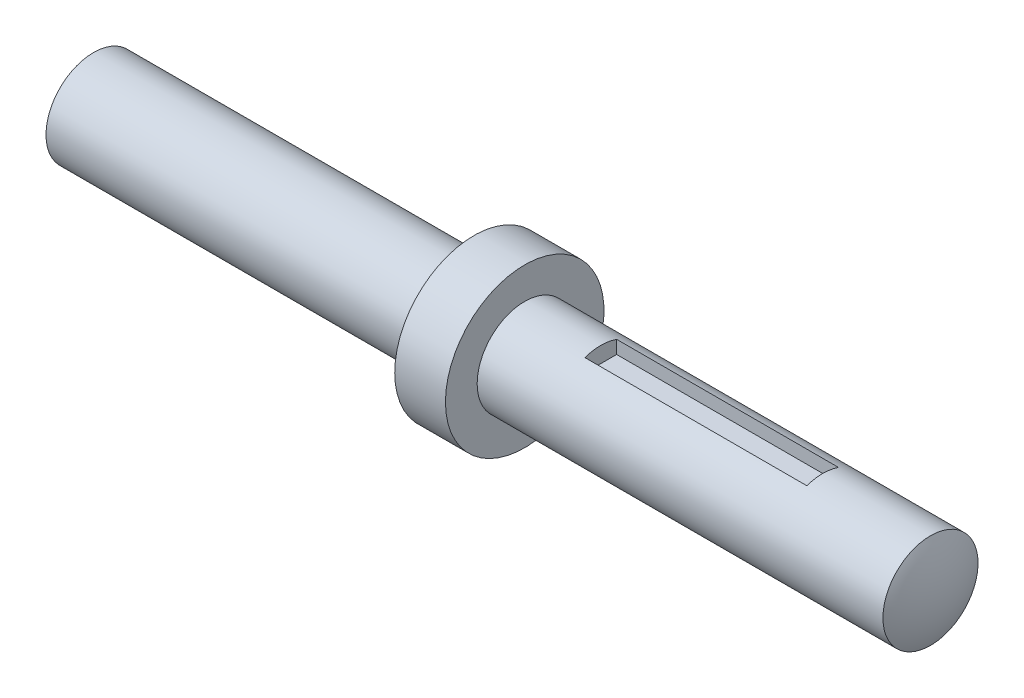
from build123d import *

# Parameters (mm, degrees)
CUT_EXTRUDE1_DEPTH = 2.5


with BuildPart() as part:
    # Sketch1 → Revolve1 (revolve)
    with BuildSketch(Plane.XY, mode=Mode.PRIVATE) as revolve1_sk:
        Polygon((-64, 7.5), (-64, 0), (68, 0), (68, 7.5), (4, 7.5), (4, 12.5), (-4, 12.5), (-4, 7.5), align=None)
        with BuildLine():
            Line((69.770509831, 0), (68, 0))
            Line((68, 0), (68, 7.5))
            ThreePointArc((68, 7.5), (69.321881746, 3.853073613), (69.770509831, 0))
        make_face()
        with BuildLine():
            Line((-64, 0), (-64, 7.5))
            ThreePointArc((-64, 7.5), (-65.321881746, 3.853073613), (-65.770509831, 0))
            Line((-65.770509831, 0), (-64, 0))
        make_face()
    revolve(revolve1_sk.sketch.rotate(Axis((-80.68485448, 0, 0), (1, 0, 0)), 90), axis=Axis((-80.68485448, 0, 0), (1, 0, 0)))

    # Sketch2 → Cut-Extrude1 (cut, symmetric)
    with BuildSketch(Plane.XY):
        Polygon((51, 10), (51, 5), (16, 5), (16, 9.65), align=None)
    extrude(amount=CUT_EXTRUDE1_DEPTH, both=True, mode=Mode.SUBTRACT)


solid = part.part
